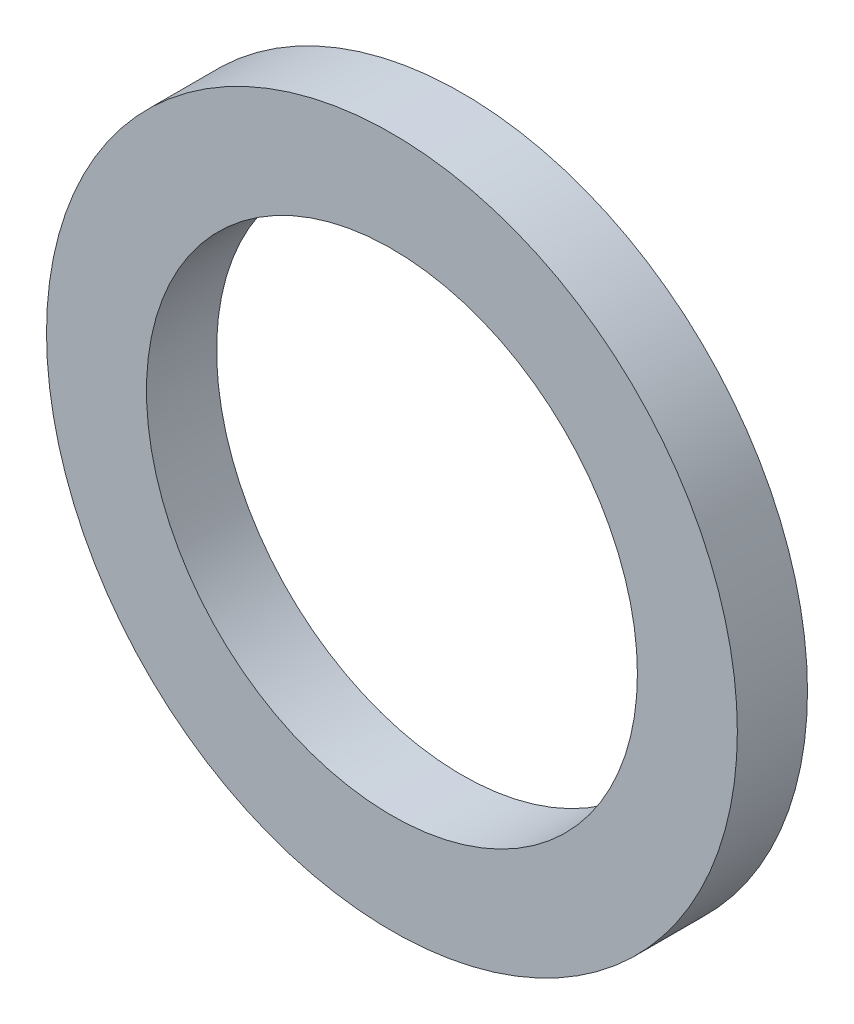
from build123d import *

# Parameters (mm, degrees)
SKETCH1_R           = 4.925
SKETCH1_R_2         = 3.5
BOSS_EXTRUDE1_DEPTH = 1


with BuildPart() as part:
    # Sketch1 → Boss-Extrude1 (new body)
    with BuildSketch(Plane.XY):
        Circle(SKETCH1_R)
        Circle(SKETCH1_R_2, mode=Mode.SUBTRACT)
    extrude(amount=BOSS_EXTRUDE1_DEPTH)


solid = part.part
